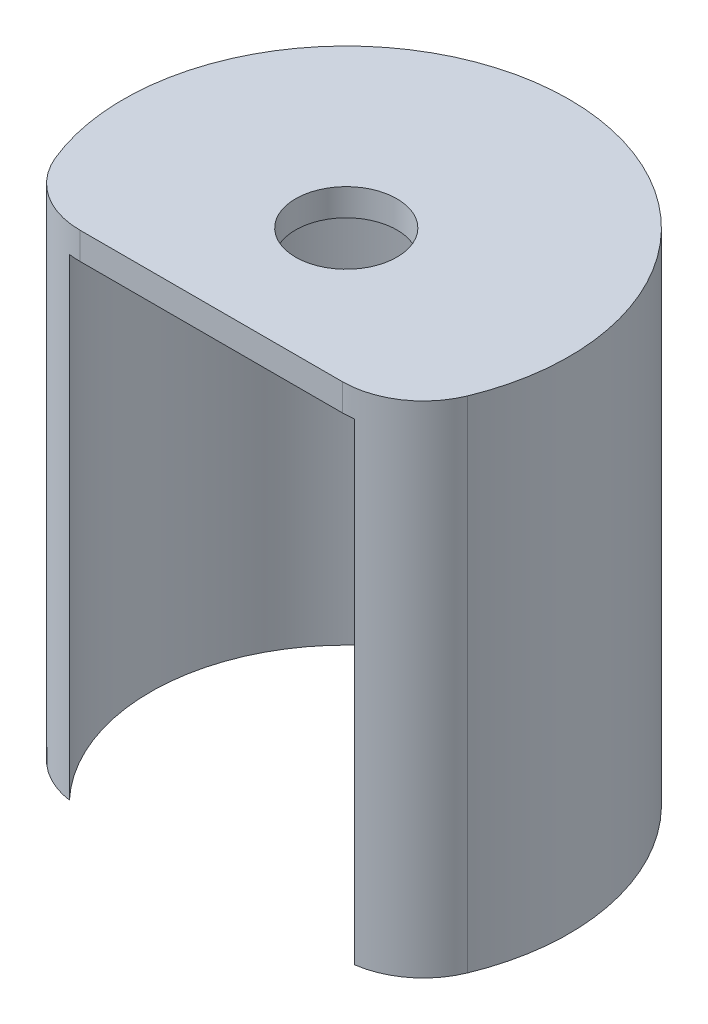
from build123d import *

# Parameters (mm, degrees)
SKETCH_1_R          = 16.5
SKETCH_1_R_2        = 14.5
EXTRUDE_1_DEPTH     = 35
SKETCH_3_R          = 16.5
EXTRUDE_2_DEPTH     = 2
SKETCH_4_W          = 49.747728002
SKETCH_4_H          = 43.690708299
CUT_EXTRUDE_1_DEPTH = 49.40970977
CUT_EXTRUDE_2_REACH = 45.744
SKETCH_5_R          = 3.75
FILLET_1_R          = 6


with BuildPart() as part:
    # 草图1 → 凸台-拉伸1 (new body)
    with BuildSketch(Plane(origin=(0, 0, 0), x_dir=(1, 0, 0), z_dir=(0, 1, 0))):
        with Locations(Location((0, 0, 0), (0, 0, 270))):
            Circle(SKETCH_1_R)
        with Locations(Location((0, 0, 0), (0, 0, 270))):
            Circle(SKETCH_1_R_2, mode=Mode.SUBTRACT)
    extrude(amount=EXTRUDE_1_DEPTH)

    # 草图3 → 凸台-拉伸2 (add)
    with BuildSketch(Plane(origin=(0, 35, 0), x_dir=(1, 0, 0), z_dir=(0, 1, 0))):
        with Locations(Location((0, 0, 0), (0, 0, 270))):
            Circle(SKETCH_3_R)
    extrude(amount=EXTRUDE_2_DEPTH)

    # 草图4 → 切除-拉伸1 (cut, through all)
    with BuildSketch(Plane.XY.offset(10)):
        with Locations((3.540684312, 17.876483266)):
            Rectangle(SKETCH_4_W, SKETCH_4_H)
    extrude(amount=CUT_EXTRUDE_1_DEPTH, mode=Mode.SUBTRACT)

    # 草图5 → 切除-拉伸2 (cut, up to next)
    with BuildSketch(Plane(origin=(0, 37, 0), x_dir=(1, 0, 0), z_dir=(0, 1, 0)), mode=Mode.PRIVATE) as cut_extrude_2_sk1:
        with Locations(Location((0, 0, 0), (0, 0, 270))):
            Circle(SKETCH_5_R)
    cut_extrude_2_tool1 = extrude(cut_extrude_2_sk1.sketch, amount=-CUT_EXTRUDE_2_REACH, mode=Mode.PRIVATE) & part.part
    add(cut_extrude_2_tool1.solids().sort_by_distance((0, 37, 0))[0], mode=Mode.SUBTRACT)

    # 圆角1
    fillet_1_edges = [part.edges().sort_by_distance(p)[0] for p in [
        (13.124404748, 18.5, 10),
        (-13.124404748, 18.5, 10),
    ]]
    fillet(fillet_1_edges, radius=FILLET_1_R)


solid = part.part
